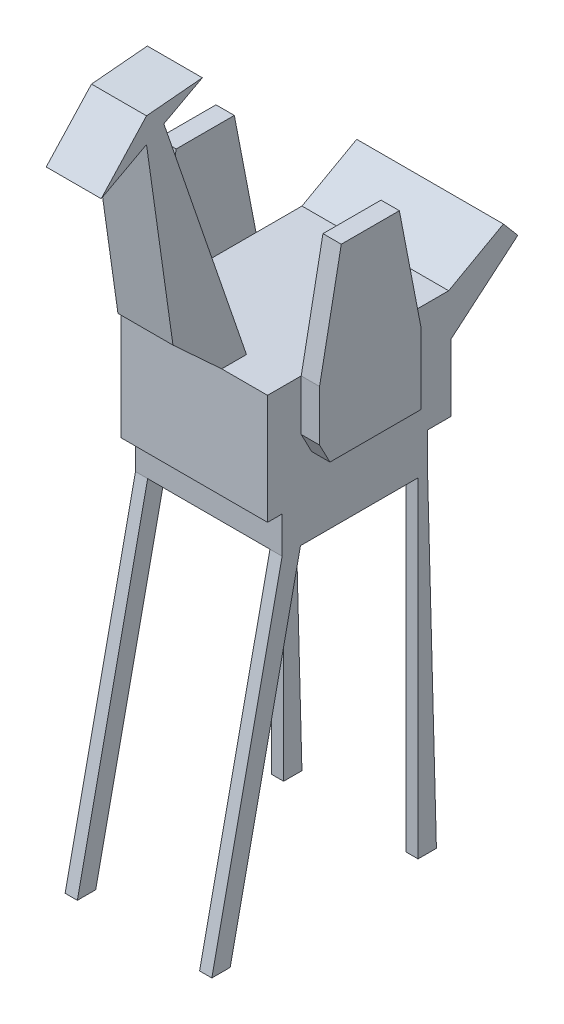
from build123d import *

# Parameters (mm, degrees)
BOSS_EXTRUDE1_DEPTH = 609.6
BOSS_EXTRUDE2_DEPTH = 228.6
BOSS_EXTRUDE3_DEPTH = 101.6
BOSS_EXTRUDE4_DEPTH = 152.4


with BuildPart() as part:
    # Sketch3 → Boss-Extrude1 (new, symmetric)
    with BuildSketch(Plane(origin=(0, 0, 0), x_dir=(0, 0, -1), z_dir=(1, 0, 0))):
        Polygon((-1403.399147583, 3962.4), (-1403.399147583, 3048), (-1281.905205668, 3048), (-1281.905205668, 2743.2), (-73.429907916, 2743.2), (-73.429907916, 3048), (120.600852417, 3048), (120.600852417, 3604.233447538), (676.481992438, 4073.884902835), (556.952807671, 4215.360072867), (102.042755684, 3962.4), align=None)
    extrude(amount=BOSS_EXTRUDE1_DEPTH, both=True)

    # Sketch4 → Boss-Extrude2 (add, symmetric)
    with BuildSketch(Plane(origin=(0, 0, 0), x_dir=(0, 0, -1), z_dir=(1, 0, 0))):
        Polygon((-1197.532980631, 3962.4), (-1884.274712895, 5966.37050229), (-1564.126997016, 6137.850814454), (-2028.302691776, 6096), (-2404.695882916, 5687.617975671), (-2028.302691776, 5889.224979914), (-1808.399476915, 4335.676386542), (-1403.399147583, 3962.4), align=None)
    extrude(amount=BOSS_EXTRUDE2_DEPTH, both=True)

    # Sketch5 → Boss-Extrude3 (add)
    with BuildSketch(Plane(origin=(609.6, 0, 0), x_dir=(0, 0, -1), z_dir=(1, 0, 0))):
        Polygon((-1281.905205668, 2743.2), (-1866.388393206, 0), (-1713.988393206, 0), (-1129.505205668, 2743.2), align=None)
        Polygon((-73.429907916, 2743.2), (0, 0), (-152.4, 0), (-152.4, 2743.2), align=None)
    boss_extrude3 = extrude(amount=-BOSS_EXTRUDE3_DEPTH)

    # Mirror1: Boss-Extrude3 across plane
    add(boss_extrude3.mirror(Plane(origin=(0, 0, 0), x_dir=(0, 0, 1), z_dir=(1, 0, 0))))

    # Sketch6 → Boss-Extrude4 (add)
    with BuildSketch(Plane(origin=(609.6, 0, 0), x_dir=(0, 0, -1), z_dir=(1, 0, 0))):
        Polygon((-942.930548368, 4895.897444272), (-1123.424597624, 3962.4), (-1123.424597624, 3540.629752292), (-1037.101356676, 3374.786165086), (-279.811106534, 3374.786165086), (-279.811106534, 3962.4), (-460.305155791, 4895.897444272), align=None)
    boss_extrude4 = extrude(amount=BOSS_EXTRUDE4_DEPTH)

    # Mirror2: Boss-Extrude4 across plane
    add(boss_extrude4.mirror(Plane(origin=(0, 0, 0), x_dir=(0, 0, 1), z_dir=(1, 0, 0))))


solid = part.part
